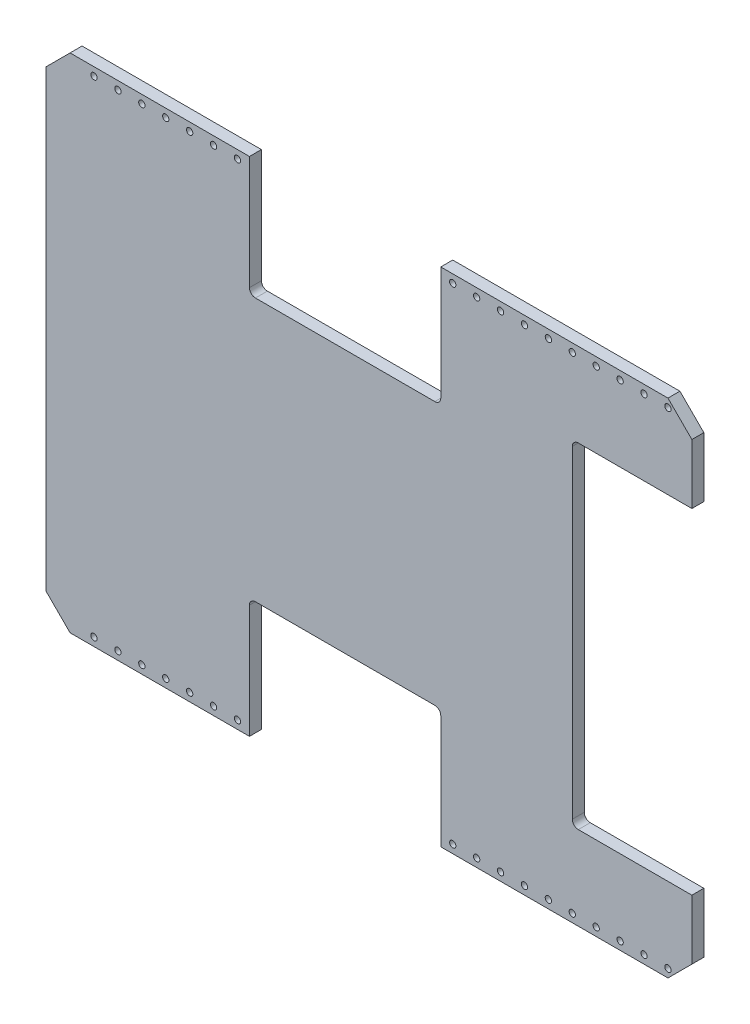
from build123d import *

# Parameters (mm, degrees)
SKETCH1_W                  = 355.6
SKETCH1_H                  = 77.724
BOSS_EXTRUDE1_DEPTH        = 22.225
SKETCH2_W                  = 74.549
SKETCH2_H                  = 19.05
CUT_EXTRUDE1_DEPTH         = 364.67400769
SKETCH3_W                  = 25.4
SKETCH3_H                  = 3.937
CUT_EXTRUDE2_DEPTH         = 817.444922817
SKETCH4_W                  = 330.2
SKETCH4_H                  = 3.175
BOSS_EXTRUDE2_DEPTH        = 15.875
SKETCH5_W                  = 69.85
SKETCH5_H                  = 3.175
BOSS_EXTRUDE3_DEPTH        = 457.2
SKETCH6_W                  = 330.2
SKETCH6_H                  = 3.175
BOSS_EXTRUDE4_DEPTH        = 3.937
SKETCH7_W                  = 330.2
SKETCH7_H                  = 3.175
BOSS_EXTRUDE5_DEPTH        = 15.875
SKETCH8_W                  = 355.6
SKETCH8_H                  = 3.175
BOSS_EXTRUDE6_DEPTH        = 3.937
SKETCH9_W                  = 355.6
SKETCH9_H                  = 3.175
BOSS_EXTRUDE7_DEPTH        = 19.05
SKETCH10_W                 = 76.358809824
SKETCH10_H                 = 3.175
BOSS_EXTRUDE8_DEPTH        = 27.432
SKETCH11_W                 = 124.052954744
SKETCH11_H                 = 3.175
BOSS_EXTRUDE9_DEPTH        = 19.05
DRAFT1_ANGLE               = 30
DRAFT2_ANGLE               = 19
M20_CLEARANCE_HOLE1_D      = 22.225
M20_CLEARANCE_HOLE1_DEPTH  = 19.050025
HOLE1_D                    = 8.128
HOLE1_DEPTH                = 22.225
M25_CLEARANCE_HOLE1_D      = 28.575
M25_CLEARANCE_HOLE1_DEPTH  = 22.225
M3_CLEARANCE_HOLE1_D       = 3.571875
M3_CLEARANCE_HOLE1_DEPTH   = 22.225
M2_CLEARANCE_HOLE1_D       = 2.54
M2_CLEARANCE_HOLE1_DEPTH   = 22.225
M3_5_CLEARANCE_HOLE1_D     = 4.064
M3_5_CLEARANCE_HOLE1_DEPTH = 22.225
HOLE2_D                    = 5.08
HOLE2_DEPTH                = 22.225
M20_CLEARANCE_HOLE2_D      = 22.225
M20_CLEARANCE_HOLE2_DEPTH  = 22.225
M25_CLEARANCE_HOLE2_D      = 28.575
M25_CLEARANCE_HOLE2_DEPTH  = 19.050025
HOLE3_D                    = 5.1054
HOLE3_DEPTH                = 19.050025
HOLE4_D                    = 8.128
HOLE4_DEPTH                = 19.050025
M3_CLEARANCE_HOLE2_D       = 3.571875
M3_CLEARANCE_HOLE2_DEPTH   = 19.050025
M6_CLEARANCE_HOLE1_D       = 6.7056
M6_CLEARANCE_HOLE1_DEPTH   = 22.225
M6_CLEARANCE_HOLE2_D       = 6.7056
M6_CLEARANCE_HOLE2_DEPTH   = 101.219
M5_CLEARANCE_HOLE1_D       = 5.334
M5_CLEARANCE_HOLE1_DEPTH   = 92.837
CHAMFER1_SIZE              = 3.175
FILLET1_R                  = 0.762
FILLET2_R                  = 3.175
FILLET3_R                  = 3.937
SKETCH48_R                 = 4.826
CUT_EXTRUDE5_DEPTH         = 819.8226487
SKETCH59_R                 = 3.3528
BOSS_EXTRUDE13_DEPTH       = 12.7
SKETCH60_W                 = 203.2
SKETCH60_H                 = 127
CUT_EXTRUDE15_DEPTH        = 863.63173587
SKETCH61_W                 = 1115.20744728
SKETCH61_H                 = 561.372878869
CUT_EXTRUDE16_DEPTH        = 863.63173587
FILLET6_R                  = 6.35
CHAMFER2_SIZE              = 25.4


with BuildPart() as part:
    # Sketch1 → Boss-Extrude1 (new body)
    with BuildSketch(Plane(origin=(0, 3.175, 0), x_dir=(1, 0, 0), z_dir=(0, 1, 0))):
        with Locations((635, 34.925)):
            Rectangle(SKETCH1_W, SKETCH1_H)
    extrude(amount=-BOSS_EXTRUDE1_DEPTH)

    # Sketch2 → Cut-Extrude1 (cut, through all)
    with BuildSketch(Plane(origin=(812.8, 0, 0), x_dir=(0, 0, -1), z_dir=(1, 0, 0))):
        with Locations((33.3375, -9.525)):
            Rectangle(SKETCH2_W, SKETCH2_H)
    extrude(amount=-CUT_EXTRUDE1_DEPTH, mode=Mode.SUBTRACT)

    # Sketch3 → Cut-Extrude2 (cut, through all)
    with BuildSketch(Plane(origin=(0, 3.175, 0), x_dir=(-1, 0, 0), z_dir=(0, 1, 0))):
        with Locations((-469.9, 1.9685)):
            Rectangle(SKETCH3_W, SKETCH3_H)
    extrude(amount=-CUT_EXTRUDE2_DEPTH, mode=Mode.SUBTRACT)

    # Sketch4 → Boss-Extrude2 (add)
    with BuildSketch(Plane(origin=(0, 3.175, 0), x_dir=(-1, 0, 0), z_dir=(0, 1, 0))):
        with Locations((-647.7, 2.3495)):
            Rectangle(SKETCH4_W, SKETCH4_H)
    extrude(amount=BOSS_EXTRUDE2_DEPTH)

    # Sketch5 → Boss-Extrude3 (add)
    with BuildSketch(Plane.ZY.offset(-457.2)):
        with Locations((-34.925, 1.5875)):
            Rectangle(SKETCH5_W, SKETCH5_H)
    extrude(amount=BOSS_EXTRUDE3_DEPTH)

    # Sketch6 → Boss-Extrude4 (add)
    with BuildSketch(Plane.XY):
        with Locations((165.1, 1.5875)):
            Rectangle(SKETCH6_W, SKETCH6_H)
    extrude(amount=BOSS_EXTRUDE4_DEPTH)

    # Sketch7 → Boss-Extrude5 (add)
    with BuildSketch(Plane(origin=(0, 3.175, 0), x_dir=(-1, 0, 0), z_dir=(0, 1, 0))):
        with Locations((-165.1, 2.3495)):
            Rectangle(SKETCH7_W, SKETCH7_H)
    extrude(amount=BOSS_EXTRUDE5_DEPTH)

    # Sketch8 → Boss-Extrude6 (add)
    with BuildSketch(Plane(origin=(0, 0, -69.85), x_dir=(-1, 0, 0), z_dir=(0, 0, -1))):
        with Locations((-177.8, 1.5875)):
            Rectangle(SKETCH8_W, SKETCH8_H)
    extrude(amount=BOSS_EXTRUDE6_DEPTH)

    # Sketch9 → Boss-Extrude7 (add)
    with BuildSketch(Plane.XZ):
        with Locations((177.8, -72.1995)):
            Rectangle(SKETCH9_W, SKETCH9_H)
    extrude(amount=BOSS_EXTRUDE7_DEPTH)

    # Sketch10 → Boss-Extrude8 (add)
    with BuildSketch(Plane(origin=(0, 0, -69.85), x_dir=(-1, 0, 0), z_dir=(0, 0, -1))):
        with Locations((-406.4, 1.5875)):
            Rectangle(SKETCH10_W, SKETCH10_H)
    extrude(amount=BOSS_EXTRUDE8_DEPTH)

    # Sketch11 → Boss-Extrude9 (add)
    with BuildSketch(Plane.XY):
        with Locations((406.4, 1.5875)):
            Rectangle(SKETCH11_W, SKETCH11_H)
    extrude(amount=BOSS_EXTRUDE9_DEPTH)

    # Draft1
    draft1_faces = [part.faces().sort_by_distance(p)[0] for p in [
        (344.373522628, 1.5875, 9.525),
        (468.426477372, 1.5875, 9.525),
    ]]
    draft(draft1_faces, Plane.XY.offset(19.05), DRAFT1_ANGLE)

    # Draft2
    draft2_faces = [part.faces().sort_by_distance(p)[0] for p in [
        (368.220595088, 1.5875, -83.566),
        (444.579404912, 1.5875, -83.566),
    ]]
    draft(draft2_faces, Plane(origin=(0, 0, -97.282), x_dir=(-1, 0, 0), z_dir=(0, 0, -1)), DRAFT2_ANGLE)

    # M20 Clearance Hole1
    with Locations(Plane(origin=(0, 0, 0), x_dir=(-1, 0, 0), z_dir=(0, -1, 0))):
        with Locations((-624.254637168, 36.83)):
            Hole(M20_CLEARANCE_HOLE1_D / 2, depth=M20_CLEARANCE_HOLE1_DEPTH)

    # Hole1
    with Locations(Plane(origin=(0, 3.175, 0), x_dir=(1, 0, 0), z_dir=(0, 1, 0))):
        with Locations((229.261562832, 36.83), (229.261562832, 62.23), (229.261562832, 11.43)):
            Hole(HOLE1_D / 2, depth=HOLE1_DEPTH)

    # M25 Clearance Hole1
    with Locations(Plane(origin=(0, 3.175, 0), x_dir=(1, 0, 0), z_dir=(0, 1, 0))):
        with Locations((147.829162832, 36.83)):
            Hole(M25_CLEARANCE_HOLE1_D / 2, depth=M25_CLEARANCE_HOLE1_DEPTH)

    # M3 Clearance Hole1
    with Locations(Plane(origin=(0, 3.175, 0), x_dir=(1, 0, 0), z_dir=(0, 1, 0))):
        with Locations((120.600362832, 65.405), (120.600362832, 8.255), (237.440362832, 8.255), (237.440362832, 65.405)):
            Hole(M3_CLEARANCE_HOLE1_D / 2, depth=M3_CLEARANCE_HOLE1_DEPTH)

    # M2 Clearance Hole1
    with Locations(Plane(origin=(0, 3.175, 0), x_dir=(1, 0, 0), z_dir=(0, 1, 0))):
        with Locations((101.6, 3.175), (101.6, 66.675), (50.8, 66.675), (50.8, 3.175), (762, 66.675), (762, 3.175), (711.2, 3.175), (711.2, 66.675)):
            Hole(M2_CLEARANCE_HOLE1_D / 2, depth=M2_CLEARANCE_HOLE1_DEPTH)

    # M3.5 Clearance Hole1
    with Locations(Plane(origin=(0, 3.175, 0), x_dir=(1, 0, 0), z_dir=(0, 1, 0))):
        with Locations((443.992, 87.85352), (368.808, 87.85352), (361.9119, -1.03886), (450.8881, -1.03886)):
            Hole(M3_5_CLEARANCE_HOLE1_D / 2, depth=M3_5_CLEARANCE_HOLE1_DEPTH)

    # Hole2
    with Locations(Plane(origin=(0, 3.175, 0), x_dir=(1, 0, 0), z_dir=(0, 1, 0))):
        with Locations((438.15, 87.85352), (374.65, 87.85352), (445.0461, -1.03886), (367.7539, -1.03886), (115.520362832, 65.405), (115.520362832, 8.255), (242.520362832, 8.255), (242.520362832, 65.405)):
            Hole(HOLE2_D / 2, depth=HOLE2_DEPTH)

    # M20 Clearance Hole2
    with Locations(Plane(origin=(0, 3.175, 0), x_dir=(1, 0, 0), z_dir=(0, 1, 0))):
        with Locations((406.4, 57.9628), (188.545362832, 36.83)):
            Hole(M20_CLEARANCE_HOLE2_D / 2, depth=M20_CLEARANCE_HOLE2_DEPTH)

    # M25 Clearance Hole2
    with Locations(Plane(origin=(0, 0, 0), x_dir=(-1, 0, 0), z_dir=(0, -1, 0))):
        with Locations((-406.4, 17.272), (-664.970837168, 36.83)):
            Hole(M25_CLEARANCE_HOLE2_D / 2, depth=M25_CLEARANCE_HOLE2_DEPTH)

    # Hole3
    with Locations(Plane(origin=(0, 0, 0), x_dir=(-1, 0, 0), z_dir=(0, -1, 0))):
        with Locations((-570.279637168, 8.255), (-570.279637168, 65.405), (-697.279637168, 65.405), (-697.279637168, 8.255)):
            Hole(HOLE3_D / 2, depth=HOLE3_DEPTH)

    # Hole4
    with Locations(Plane(origin=(0, 0, 0), x_dir=(-1, 0, 0), z_dir=(0, -1, 0))):
        with Locations((-583.538437168, 11.43), (-583.538437168, 36.83), (-583.538437168, 62.23)):
            Hole(HOLE4_D / 2, depth=HOLE4_DEPTH)

    # M3 Clearance Hole2
    with Locations(Plane(origin=(0, 0, 0), x_dir=(-1, 0, 0), z_dir=(0, -1, 0))):
        with Locations((-692.199637168, 8.255), (-692.199637168, 65.405), (-575.359637168, 65.405), (-575.359637168, 8.255)):
            Hole(M3_CLEARANCE_HOLE2_D / 2, depth=M3_CLEARANCE_HOLE2_DEPTH)

    # M6 Clearance Hole1
    with Locations(Plane(origin=(0, 3.175, 0), x_dir=(1, 0, 0), z_dir=(0, 1, 0))):
        with Locations((612.775, 10.287), (498.475, 10.287), (314.325, 10.287), (200.025, 10.287), (628.319218584, 61.976), (184.480781416, 61.976), (690.88, 15.875), (739.902, 9.525), (121.92, 15.875), (72.898, 9.525), (298.874532383, 17.547282407), (513.925467617, 17.547282407), (165.1, 14.732), (266.7, 14.732), (546.1, 14.732), (647.7, 14.732), (330.2, 61.722), (279.4, 61.722), (139.7, 61.722), (25.4, 61.722), (482.6, 61.722), (533.4, 61.722), (673.1, 61.722), (787.4, 61.722), (6.35, 39.497), (806.45, 39.497), (350.8375, -12.8905), (461.9625, -12.8905)):
            Hole(M6_CLEARANCE_HOLE1_D / 2, depth=M6_CLEARANCE_HOLE1_DEPTH)

    # M6 Clearance Hole2
    with Locations(Plane.XY.offset(3.937)):
        with Locations((495.3, 12.7), (520.7, 12.7), (546.1, 12.7), (571.5, 12.7), (596.9, 12.7), (622.3, 12.7), (647.7, 12.7), (673.1, 12.7), (698.5, 12.7), (723.9, 12.7), (749.3, 12.7), (774.7, 12.7), (800.1, 12.7), (317.5, 12.7), (292.1, 12.7), (266.7, 12.7), (241.3, 12.7), (215.9, 12.7), (190.5, 12.7), (165.1, 12.7), (139.7, 12.7), (114.3, 12.7), (88.9, 12.7), (63.5, 12.7), (12.7, 12.7), (38.1, 12.7)):
            Hole(M6_CLEARANCE_HOLE2_D / 2, depth=M6_CLEARANCE_HOLE2_DEPTH)

    # M5 Clearance Hole1
    with Locations(Plane(origin=(0, 0, -73.787), x_dir=(-1, 0, 0), z_dir=(0, 0, -1))):
        with Locations((-469.9, -12.7), (-495.3, -12.7), (-520.7, -12.7), (-546.1, -12.7), (-571.5, -12.7), (-596.9, -12.7), (-622.3, -12.7), (-647.7, -12.7), (-673.1, -12.7), (-698.5, -12.7), (-723.9, -12.7), (-749.3, -12.7), (-774.7, -12.7), (-800.1, -12.7), (-342.9, -12.7), (-317.5, -12.7), (-292.1, -12.7), (-266.7, -12.7), (-241.3, -12.7), (-215.9, -12.7), (-190.5, -12.7), (-165.1, -12.7), (-139.7, -12.7), (-114.3, -12.7), (-88.9, -12.7), (-63.5, -12.7), (-38.1, -12.7), (-12.7, -12.7)):
            Hole(M5_CLEARANCE_HOLE1_D / 2, depth=M5_CLEARANCE_HOLE1_DEPTH)

    # Chamfer1
    chamfer1_edges = [part.edges().sort_by_distance(p)[0] for p in [
        (482.6, 19.05, 2.3495),
        (0, 19.05, 2.3495),
        (812.8, 19.05, 2.3495),
        (812.8, -19.05, -72.1995),
        (457.2, -19.05, -72.1995),
        (0, -19.05, -72.1995),
        (330.2, 19.05, 2.3495),
        (355.6, -19.05, -72.1995),
    ]]
    chamfer(chamfer1_edges, length=CHAMFER1_SIZE)

    # Fillet1
    fillet1_edges = [part.edges().sort_by_distance(p)[0] for p in [
        (647.7, 3.175, 0.762),
        (177.8, 0, -70.612),
        (635, 0, -70.612),
        (165.1, 3.175, 0.762),
    ]]
    fillet(fillet1_edges, radius=FILLET1_R)

    # Fillet2
    fillet2_edges = [part.edges().sort_by_distance(p)[0] for p in [
        (368.220595088, 1.5875, -97.282),
        (333.375, 1.5875, 0),
        (344.373522628, 1.5875, 19.05),
        (444.579404912, 1.5875, -97.282),
        (358.775, 1.5875, -69.85),
        (479.425, 1.5875, 0),
        (468.426477372, 1.5875, 19.05),
        (454.025, 1.5875, -69.85),
    ]]
    fillet(fillet2_edges, radius=FILLET2_R)

    # Fillet3
    fillet3_edges = [part.edges().sort_by_distance(p)[0] for p in [
        (165.1, 0, 3.937),
        (647.7, 0, 3.937),
        (635, 3.175, -73.787),
        (177.8, 3.175, -73.787),
    ]]
    fillet(fillet3_edges, radius=FILLET3_R)

    # Sketch48 → Cut-Extrude5 (cut, through all)
    with BuildSketch(Plane(origin=(0, 0, 0), x_dir=(-1, 0, 0), z_dir=(0, -1, 0))):
        with Locations(Location((-601.438495912, 19.05, 0), (0, 0, 90))):
            Circle(SKETCH48_R)
        with Locations(Location((-628.947697627, 19.05, 0), (0, 0, 90))):
            Circle(SKETCH48_R)
        with Locations(Location((-701.450372003, 20.828, 0), (0, 0, 90))):
            Circle(SKETCH48_R)
        with Locations(Location((-726.460886343, 20.828, 0), (0, 0, 90))):
            Circle(SKETCH48_R)
        with Locations(Location((-568.924874752, 19.05, 0), (0, 0, 90))):
            Circle(SKETCH48_R)
        with Locations(Location((-678.054138508, 20.828, 0), (0, 0, 90))):
            Circle(SKETCH48_R)
        with Locations(Location((-243.875125248, 19.05, 0), (0, 0, 270))):
            Circle(SKETCH48_R)
        with Locations(Location((-211.361504088, 19.05, 0), (0, 0, 270))):
            Circle(SKETCH48_R)
        with Locations(Location((-183.852302373, 19.05, 0), (0, 0, 270))):
            Circle(SKETCH48_R)
        with Locations(Location((-134.745861492, 20.828, 0), (0, 0, 270))):
            Circle(SKETCH48_R)
        with Locations(Location((-111.349627997, 20.828, 0), (0, 0, 270))):
            Circle(SKETCH48_R)
        with Locations(Location((-86.339113657, 20.828, 0), (0, 0, 270))):
            Circle(SKETCH48_R)
    extrude(amount=-CUT_EXTRUDE5_DEPTH, mode=Mode.SUBTRACT)

    # Sketch59 → Boss-Extrude13 (add)
    with BuildSketch(Plane(origin=(0, 0, 3.937), x_dir=(-1, 0, 0), z_dir=(0, 0, -1))):
        Polygon((-63.5, 3.937), (-749.3, 3.937), (-749.3, 92.837), (-622.3, 92.837), (-622.3, 270.637), (-63.5, 270.637), align=None)
        with Locations(Location((-596.9, 12.7, 0), (0, 0, 270))):
            Circle(SKETCH59_R, mode=Mode.SUBTRACT)
        with Locations(Location((-571.5, 12.7, 0), (0, 0, 270))):
            Circle(SKETCH59_R, mode=Mode.SUBTRACT)
        with Locations(Location((-546.1, 12.7, 0), (0, 0, 270))):
            Circle(SKETCH59_R, mode=Mode.SUBTRACT)
        with Locations(Location((-520.7, 12.7, 0), (0, 0, 270))):
            Circle(SKETCH59_R, mode=Mode.SUBTRACT)
        with Locations(Location((-495.3, 12.7, 0), (0, 0, 270))):
            Circle(SKETCH59_R, mode=Mode.SUBTRACT)
        with Locations(Location((-317.5, 12.7, 0), (0, 0, 270))):
            Circle(SKETCH59_R, mode=Mode.SUBTRACT)
        with Locations(Location((-292.1, 12.7, 0), (0, 0, 270))):
            Circle(SKETCH59_R, mode=Mode.SUBTRACT)
        with Locations(Location((-266.7, 12.7, 0), (0, 0, 270))):
            Circle(SKETCH59_R, mode=Mode.SUBTRACT)
        with Locations(Location((-241.3, 12.7, 0), (0, 0, 270))):
            Circle(SKETCH59_R, mode=Mode.SUBTRACT)
        with Locations(Location((-215.9, 12.7, 0), (0, 0, 270))):
            Circle(SKETCH59_R, mode=Mode.SUBTRACT)
        with Locations(Location((-190.5, 12.7, 0), (0, 0, 270))):
            Circle(SKETCH59_R, mode=Mode.SUBTRACT)
        with Locations(Location((-165.1, 12.7, 0), (0, 0, 270))):
            Circle(SKETCH59_R, mode=Mode.SUBTRACT)
        with Locations(Location((-139.7, 12.7, 0), (0, 0, 270))):
            Circle(SKETCH59_R, mode=Mode.SUBTRACT)
        with Locations(Location((-114.3, 12.7, 0), (0, 0, 270))):
            Circle(SKETCH59_R, mode=Mode.SUBTRACT)
        with Locations(Location((-723.9, 12.7, 0), (0, 0, 270))):
            Circle(SKETCH59_R, mode=Mode.SUBTRACT)
        with Locations(Location((-698.5, 12.7, 0), (0, 0, 270))):
            Circle(SKETCH59_R, mode=Mode.SUBTRACT)
        with Locations(Location((-673.1, 12.7, 0), (0, 0, 270))):
            Circle(SKETCH59_R, mode=Mode.SUBTRACT)
        with Locations(Location((-647.7, 12.7, 0), (0, 0, 270))):
            Circle(SKETCH59_R, mode=Mode.SUBTRACT)
        with Locations(Location((-622.3, 12.7, 0), (0, 0, 270))):
            Circle(SKETCH59_R, mode=Mode.SUBTRACT)
    extrude(amount=-BOSS_EXTRUDE13_DEPTH)

    # Sketch60 → Cut-Extrude15 (cut, through all)
    with BuildSketch(Plane(origin=(0, 0, 3.937), x_dir=(-1, 0, 0), z_dir=(0, 0, -1))):
        with Locations((-381, 67.437)):
            Rectangle(SKETCH60_W, SKETCH60_H)
    extrude(amount=-CUT_EXTRUDE15_DEPTH, mode=Mode.SUBTRACT)

    # Sketch61 → Cut-Extrude16 (cut, through all)
    with BuildSketch(Plane(origin=(0, 0, 3.937), x_dir=(-1, 0, 0), z_dir=(0, 0, -1))):
        with Locations((-533.034521332, 184.9425713)):
            Rectangle(SKETCH61_W, SKETCH61_H)
    extrude(amount=CUT_EXTRUDE16_DEPTH, mode=Mode.SUBTRACT)


with BuildPart() as cut_extrude16_kept_piece:
    # of the separate pieces the step leaves, the one the design keeps (cut_extrude16_pieces_kept)
    add(part.part.solids().sort_by_distance((749.3, 3.937, 3.937))[0])

    # Fillet6
    fillet6_edges = [cut_extrude16_kept_piece.edges().sort_by_distance(p)[0] for p in [
        (622.3, 92.837, 10.287),
        (482.6, 130.937, 10.287),
        (279.4, 130.937, 10.287),
    ]]
    fillet(fillet6_edges, radius=FILLET6_R)

    # Chamfer2
    chamfer2_edges = [cut_extrude16_kept_piece.edges().sort_by_distance(p)[0] for p in [
        (63.5, 3.937, 10.287),
        (749.3, 3.937, 10.287),
    ]]
    chamfer(chamfer2_edges, length=CHAMFER2_SIZE)

    # Mirror1: Cut-Extrude16 kept piece across plane


with BuildPart() as cut_extrude16_kept_piece_1:
    add(cut_extrude16_kept_piece.part)
    add(cut_extrude16_kept_piece.part.mirror(Plane(origin=(63.5, 270.637, 16.637), x_dir=(0, 0, 1), z_dir=(0, 1, 0))))


solid = cut_extrude16_kept_piece_1.part
